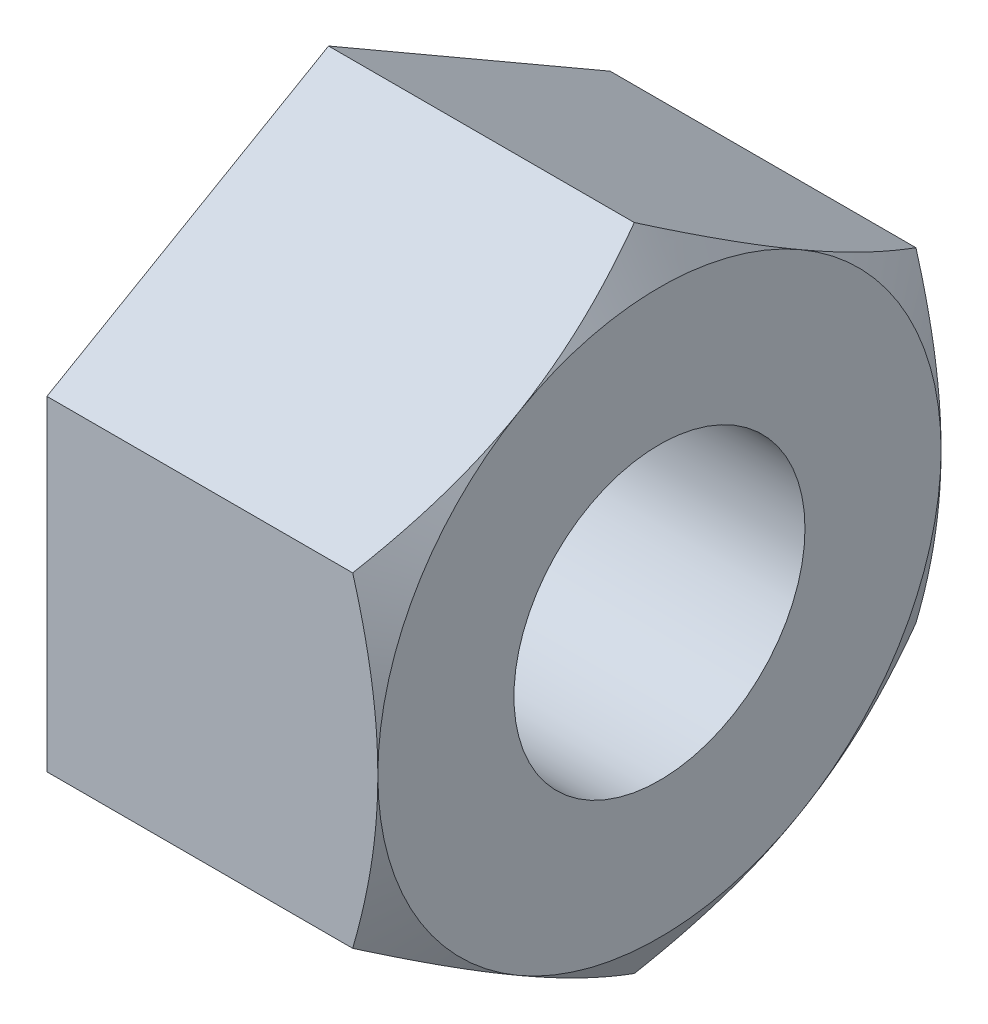
from build123d import *

# Parameters (mm, degrees)
BOSS_EXTRUDE1_DEPTH = 4.7
TAP1_D              = 4.134


with BuildPart() as part:
    # Sketch1 → Boss-Extrude1 (new body)
    with BuildSketch(Plane(origin=(0, 0, 0), x_dir=(0, 0, -1), z_dir=(1, 0, 0))):
        Polygon((0, 4.618802154), (-4, 2.309401077), (-4, -2.309401077), (0, -4.618802154), (4, -2.309401077), (4, 2.309401077), align=None)
    extrude(amount=-BOSS_EXTRUDE1_DEPTH)

    # Sketch2 → Cut-Revolve1 (revolve, cut)
    with BuildSketch(Plane.XY):
        Polygon((0, 4), (-0.35726559, 4.618802154), (0, 4.618802154), align=None)
    revolve(axis=Axis((-0.35726559, 0, 0), (1, 0, 0)), mode=Mode.SUBTRACT)

    # Tap1 (through all)
    with Locations(Plane(origin=(0, 0, 0), x_dir=(0, 0, -1), z_dir=(1, 0, 0))):
        with Locations((0, 0)):
            Hole(TAP1_D / 2)


solid = part.part
